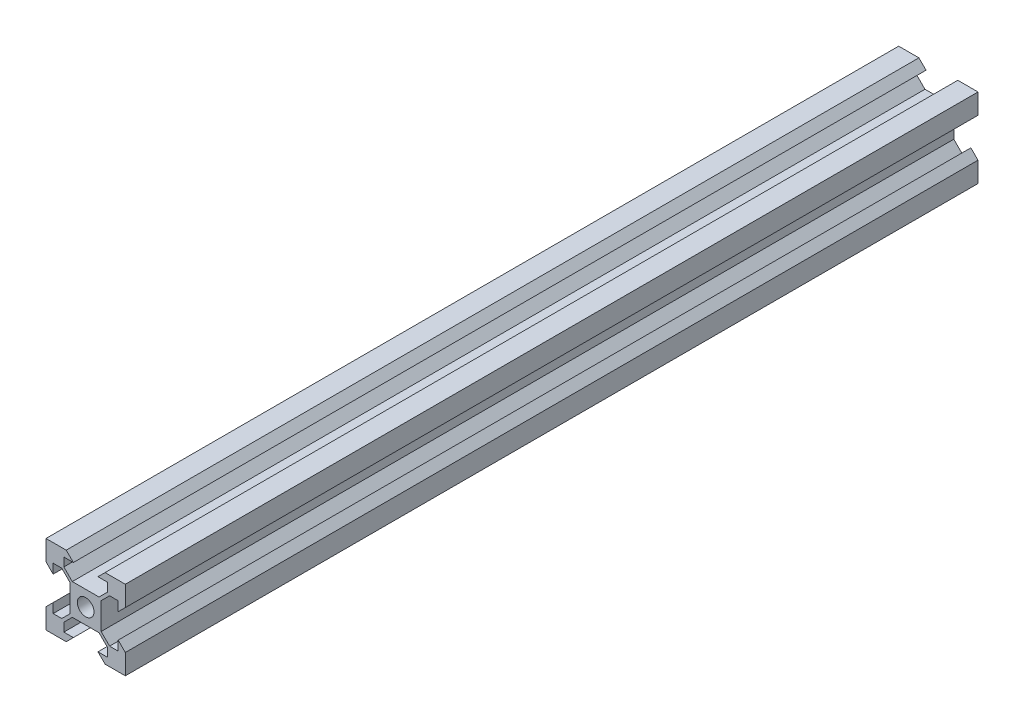
from build123d import *

# Parameters (mm, degrees)
SKETCH_1_R      = 2.1
EXTRUDE_1_DEPTH = 107.5


with BuildPart() as part:
    # 草图1 → 凸台-拉伸1 (new, symmetric)
    with BuildSketch(Plane.XY):
        Polygon((3.369669914, 3.9), (-3.369669914, 3.9), (-5.5, 6.030330086), (-5.5, 8.2), (-3.1, 8.2), (-4.9, 10), (-10, 10), (-10, 4.9), (-8.2, 3.1), (-8.2, 5.5), (-6.030330086, 5.5), (-3.9, 3.369669914), (-3.9, -3.369669914), (-6.030330086, -5.5), (-8.2, -5.5), (-8.2, -3.1), (-10, -4.9), (-10, -10), (-4.9, -10), (-3.1, -8.2), (-5.5, -8.2), (-5.5, -6.030330086), (-3.369669914, -3.9), (3.369669914, -3.9), (5.5, -6.030330086), (5.5, -8.2), (3.1, -8.2), (4.9, -10), (10, -10), (10, -4.9), (8.2, -3.1), (8.2, -5.5), (6.030330086, -5.5), (3.9, -3.369669914), (3.9, 3.369669914), (6.030330086, 5.5), (8.2, 5.5), (8.2, 3.1), (10, 4.9), (10, 10), (4.9, 10), (3.1, 8.2), (5.5, 8.2), (5.5, 6.030330086), align=None)
        Circle(SKETCH_1_R, mode=Mode.SUBTRACT)
    extrude(amount=EXTRUDE_1_DEPTH, both=True)


solid = part.part
